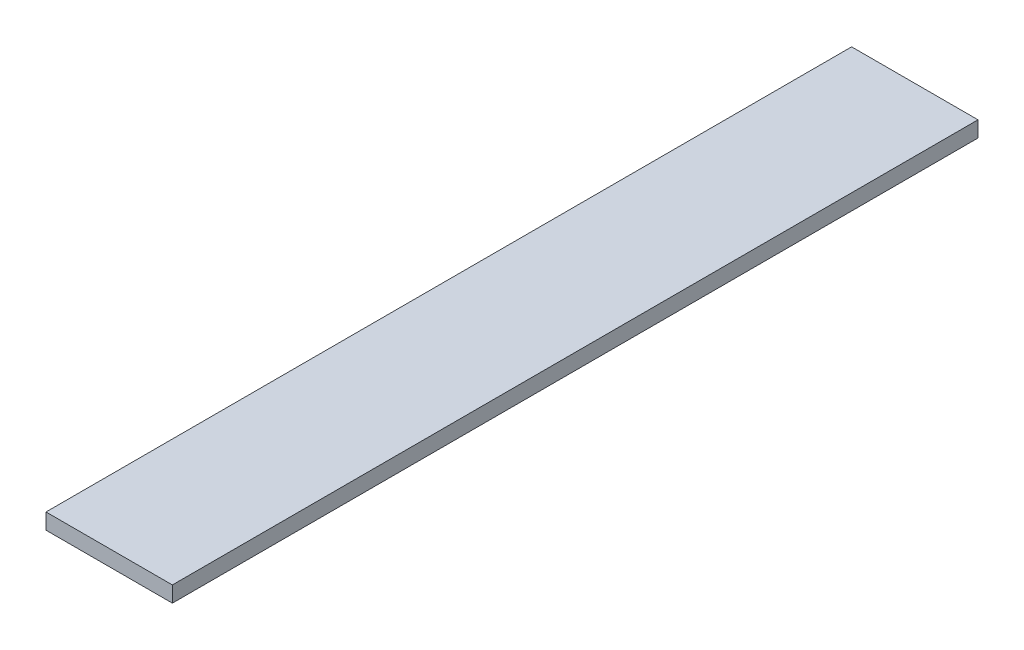
from build123d import *

# Parameters (mm, degrees)
SKETCH1_W           = 101.6
SKETCH1_H           = 647.7
BOSS_EXTRUDE1_DEPTH = 12.7


with BuildPart() as part:
    # Sketch1 → Boss-Extrude1 (new body)
    with BuildSketch(Plane(origin=(0, 0, 0), x_dir=(1, 0, 0), z_dir=(0, 1, 0))):
        Rectangle(SKETCH1_W, SKETCH1_H)
    extrude(amount=BOSS_EXTRUDE1_DEPTH)


solid = part.part
